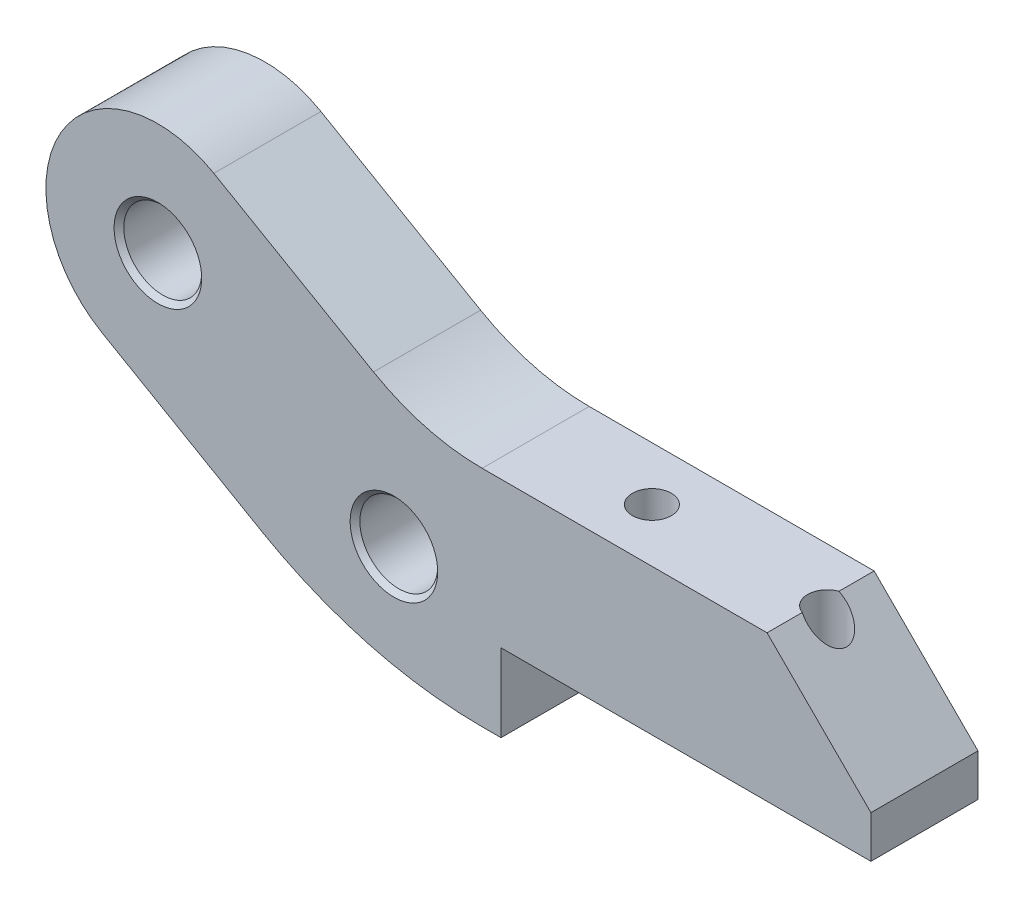
from build123d import *

# Parameters (mm, degrees)
BASE_EXTRUSION_DEPTH    = 11
ESQUISSE2_R             = 4
ENL_V_MAT_EXTRU_1_DEPTH = 79.487260113
CHANFREIN1_SIZE         = 0.5
ESQUISSE3_R             = 4
ENL_V_MAT_EXTRU_3_DEPTH = 76.099025835
CHANFREIN2_SIZE         = 0.5
ESQUISSE4_R             = 2
ENL_V_MAT_EXTRU_4_DEPTH = 21.849235277


with BuildPart() as part:
    # Esquisse1 → Base-Extrusion (new body)
    with BuildSketch(Plane.XY):
        with BuildLine():
            Line((23.059250232, 31.5), (52.331191161, 31.5))
            Line((52.331191161, 31.5), (63, 20.831191161))
            Line((63, 20.831191161), (63, 16.5))
            Line((63, 16.5), (25, 16.5))
            Line((25, 16.5), (25, 8.5))
            Line((25, 8.5), (23.059250232, 8.5))
            ThreePointArc((23.059250232, 8.5), (11.332267447, 10.043886573), (0.40445916, 14.570332972))
            Line((0.40445916, 14.570332972), (-15.998711306, 24.040707856))
            ThreePointArc((-15.998711306, 24.040707856), (-20.208003449, 39.75), (-4.498711306, 43.959292144))
            Line((-4.498711306, 43.959292144), (11.90445916, 34.488917259))
            ThreePointArc((11.90445916, 34.488917259), (17.285105485, 32.260180577), (23.059250232, 31.5))
        make_face()
    extrude(amount=BASE_EXTRUSION_DEPTH)

    # Esquisse2 → Enlèv. mat.-Extru.1 (cut, through all)
    with BuildSketch(Plane.XY.offset(11)):
        with Locations((-10.248711306, 34)):
            Circle(ESQUISSE2_R)
    extrude(amount=-ENL_V_MAT_EXTRU_1_DEPTH, mode=Mode.SUBTRACT)

    # Chanfrein1
    chanfrein1_edges = [part.edges().sort_by_distance(p)[0] for p in [
        (-14.248711306, 34, 0),
        (-14.248711306, 34, 11),
    ]]
    chamfer(chanfrein1_edges, length=CHANFREIN1_SIZE)

    # Esquisse3 → Enlèv. mat.-Extru.3 (cut, through all)
    with BuildSketch(Plane(origin=(23.483322458, -13.431543362, 11), x_dir=(1, 0, 0), z_dir=(0, 0, 1))):
        with Locations((-9.483322458, 33.431543362)):
            Circle(ESQUISSE3_R)
    extrude(amount=-ENL_V_MAT_EXTRU_3_DEPTH, mode=Mode.SUBTRACT)

    # Chanfrein2
    chanfrein2_edges = [part.edges().sort_by_distance(p)[0] for p in [
        (10, 20, 0),
        (10, 20, 11),
    ]]
    chamfer(chanfrein2_edges, length=CHANFREIN2_SIZE)

    # Esquisse4 → Enlèv. mat.-Extru.4 (cut)
    with BuildSketch(Plane.XZ.offset(-16.5)):
        with Locations(Location((35, 5.5, 0), (0, 0, 270))):
            Circle(ESQUISSE4_R)
        with Locations(Location((53, 5.5, 0), (0, 0, 270))):
            Circle(ESQUISSE4_R)
    extrude(amount=-ENL_V_MAT_EXTRU_4_DEPTH, mode=Mode.SUBTRACT)


solid = part.part
